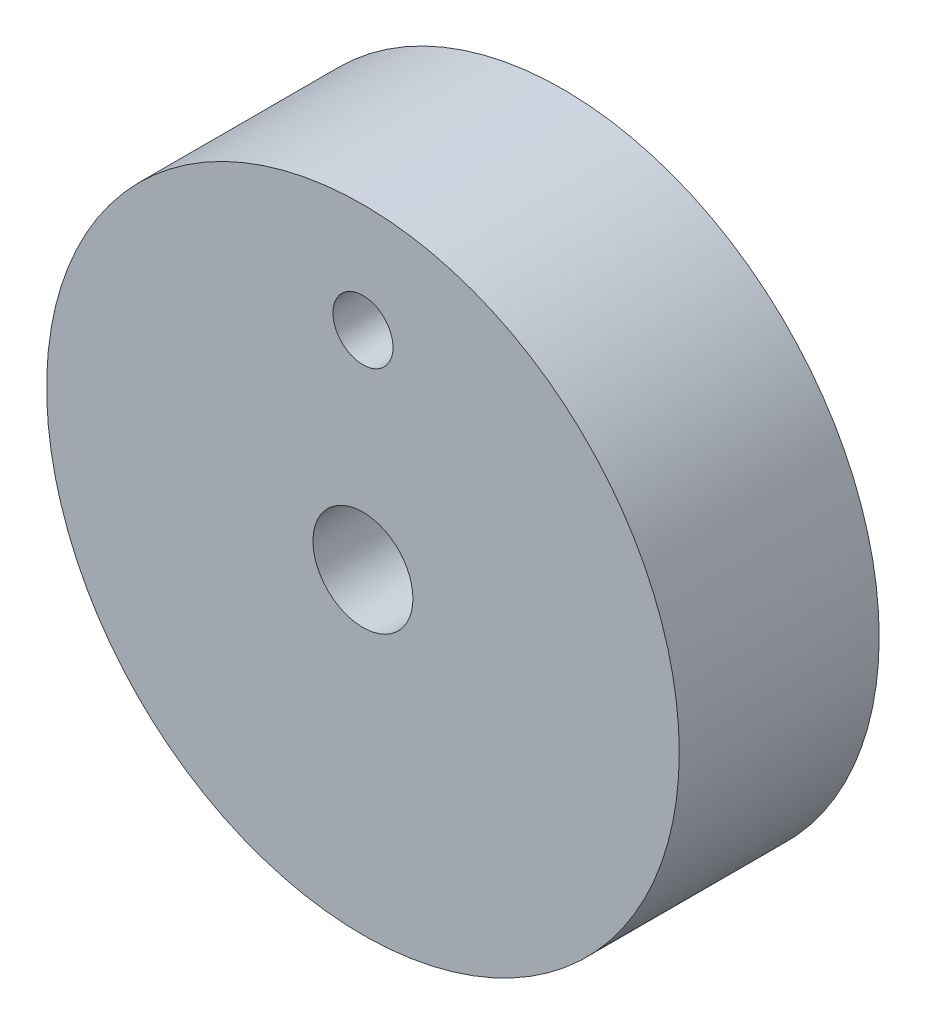
from build123d import *

# Parameters (mm, degrees)
SKETCH1_R           = 317.5
SKETCH1_R_2         = 50.165
BOSS_EXTRUDE1_DEPTH = 200.66
SKETCH2_R           = 30.125476956
CUT_EXTRUDE1_DEPTH  = 254


with BuildPart() as part:
    # Sketch1 → Boss-Extrude1 (new body)
    with BuildSketch(Plane.XY):
        Circle(SKETCH1_R)
        Circle(SKETCH1_R_2, mode=Mode.SUBTRACT)
    extrude(amount=BOSS_EXTRUDE1_DEPTH)

    # Sketch2 → Cut-Extrude1 (cut)
    with BuildSketch(Plane.XY.offset(200.66)):
        with Locations((0, 208.338633527)):
            Circle(SKETCH2_R)
    extrude(amount=-CUT_EXTRUDE1_DEPTH, mode=Mode.SUBTRACT)


solid = part.part
